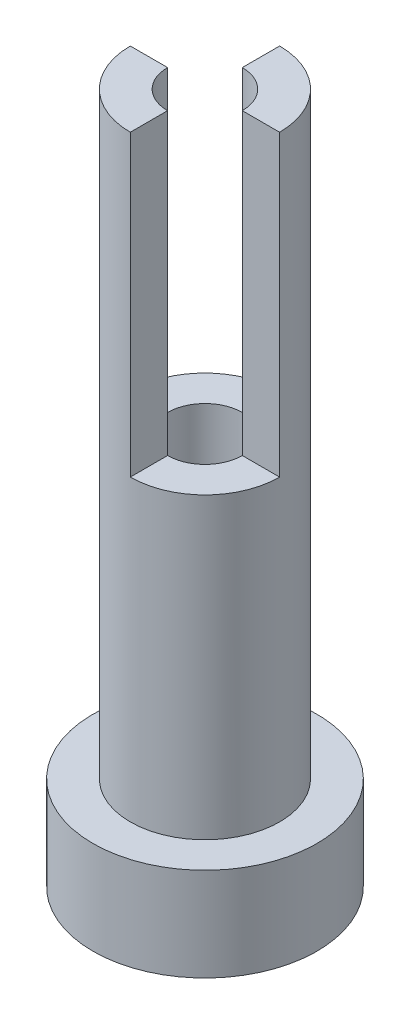
from build123d import *

# Parameters (mm, degrees)
SKETCH_1_R          = 2
SKETCH_1_R_2        = 1
EXTRUDE_1_DEPTH     = 29
SKETCH_2_R          = 3
SKETCH_2_R_2        = 2
EXTRUDE_2_DEPTH     = 2.5
EXTRUDE_START       = 26.5
SKETCH_3_R          = 3
SKETCH_3_R_2        = 2
EXTRUDE_3_DEPTH     = 2.5
SKETCH_4_R          = 1.6
CUT_EXTRUDE_1_DEPTH = 1.5
CUT_EXTRUDE_START   = 29
CUT_EXTRUDE_2_DEPTH = 1.6
CUT_EXTRUDE_START_2 = 18.5
SKETCH_7_R          = 3
CUT_EXTRUDE_3_DEPTH = 10.5
CUT_EXTRUDE_START_3 = 10.5
CUT_EXTRUDE_5_DEPTH = 8


with BuildPart() as part:
    # 草图1 → 凸台-拉伸1 (new body)
    with BuildSketch(Plane(origin=(0, 0, 0), x_dir=(1, 0, 0), z_dir=(0, 1, 0))):
        with Locations(Location((0, 0, 0), (0, 0, 90))):
            Circle(SKETCH_1_R)
        with Locations(Location((0, 0, 0), (0, 0, 90))):
            Circle(SKETCH_1_R_2, mode=Mode.SUBTRACT)
    extrude(amount=EXTRUDE_1_DEPTH)

    # 草图2 → 凸台-拉伸2 (add)
    with BuildSketch(Plane(origin=(0, 0, 0), x_dir=(1, 0, 0), z_dir=(0, 1, 0))):
        with Locations(Location((0, 0, 0), (0, 0, 270))):
            Circle(SKETCH_2_R)
        with Locations(Location((0, 0, 0), (0, 0, 90))):
            Circle(SKETCH_2_R_2, mode=Mode.SUBTRACT)
    extrude(amount=EXTRUDE_2_DEPTH)

    # 草图3 → 凸台-拉伸3 (add)
    with BuildSketch(Plane(origin=(0, 0, 0), x_dir=(1, 0, 0), z_dir=(0, 1, 0)).offset(EXTRUDE_START)):
        with Locations(Location((0, 0, 0), (0, 0, 270))):
            Circle(SKETCH_3_R)
        with Locations(Location((0, 0, 0), (0, 0, 90))):
            Circle(SKETCH_3_R_2, mode=Mode.SUBTRACT)
    extrude(amount=EXTRUDE_3_DEPTH)

    # 草图4 → 切除-拉伸1 (cut)
    with BuildSketch(Plane(origin=(0, 0, 0), x_dir=(1, 0, 0), z_dir=(0, 1, 0))):
        with Locations(Location((0, 0, 0), (0, 0, 270))):
            Circle(SKETCH_4_R)
    extrude(amount=CUT_EXTRUDE_1_DEPTH, mode=Mode.SUBTRACT)

    # 草图5 → 切除-拉伸2 (cut)
    with BuildSketch(Plane(origin=(0, 0, 0), x_dir=(1, 0, 0), z_dir=(0, 1, 0)).offset(CUT_EXTRUDE_START)):
        Polygon((0, -2.309401077), (2, -1.154700538), (2, 1.154700538), (0, 2.309401077), (-2, 1.154700538), (-2, -1.154700538), align=None)
    extrude(amount=-CUT_EXTRUDE_2_DEPTH, mode=Mode.SUBTRACT)

    # 草图7 → 切除-拉伸3 (cut)
    with BuildSketch(Plane(origin=(0, 0, 0), x_dir=(1, 0, 0), z_dir=(0, 1, 0)).offset(CUT_EXTRUDE_START_2)):
        with Locations(Location((0, 0, 0), (0, 0, 270))):
            Circle(SKETCH_7_R)
    extrude(amount=CUT_EXTRUDE_3_DEPTH, mode=Mode.SUBTRACT)

    # 草图8 → 切除-拉伸5 (cut)
    with BuildSketch(Plane(origin=(0, 0, 0), x_dir=(1, 0, 0), z_dir=(0, 1, 0)).offset(CUT_EXTRUDE_START_3)):
        with BuildLine():
            ThreePointArc((0, -2), (1.414213562, -1.414213562), (2, 0))
            Line((2, 0), (0, 0))
            Line((0, 0), (0, -2))
        make_face()
        with BuildLine():
            Line((-2, 0), (0, 0))
            Line((0, 0), (0, 2))
            ThreePointArc((0, 2), (-1.414213562, 1.414213562), (-2, 0))
        make_face()
    extrude(amount=CUT_EXTRUDE_5_DEPTH, mode=Mode.SUBTRACT)


solid = part.part
